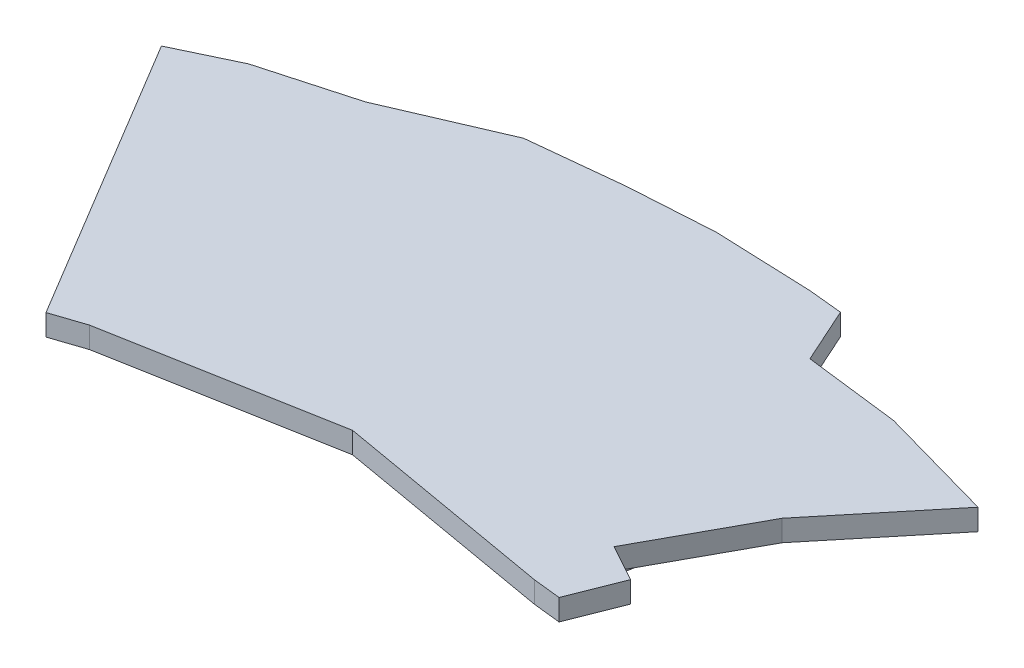
from build123d import *

# Parameters (mm, degrees)
BOSS_EXTRUDE1_DEPTH = 0.1
BOSS_EXTRUDE2_DEPTH = 0.3
BOSS_EXTRUDE3_DEPTH = 1.6
BOSS_EXTRUDE4_DEPTH = 1
BOSS_EXTRUDE6_DEPTH = 2


with BuildPart() as part:
    # Sketch1 → Boss-Extrude1 (new body)
    with BuildSketch(Plane(origin=(0, 0, 0), x_dir=(1, 0, 0), z_dir=(0, 1, 0))):
        Polygon((-10.891797249, 26.577808825), (-5.79351947, 9.149986826), (-2.397224373, 3.489407839), (5.640466214, 5.66196227), (-0.734212813, 29.279724171), align=None)
    extrude(amount=-BOSS_EXTRUDE1_DEPTH)



with BuildPart() as body_2:
    # Sketch1<4> → Boss-Extrude2 (new body)
    with BuildSketch(Plane(origin=(0, 0, 0), x_dir=(1, 0, 0), z_dir=(0, 1, 0))):
        Polygon((18.007446345, 34.7772024), (7.705525211, 33.438949507), (11.001219022, 9.275344539), (21.345127352, 10.801402821), align=None)
    extrude(amount=-BOSS_EXTRUDE2_DEPTH)


with BuildPart() as body_3:
    # Sketch1<6> → Boss-Extrude3 (new body)
    with BuildSketch(Plane(origin=(0, 0, 0), x_dir=(1, 0, 0), z_dir=(0, 1, 0))):
        Polygon((34.248462201, 34.6301789), (23.994142325, 35.215869617), (23.110432029, 10.99610324), (33.233450435, 10.417934204), align=None)
    extrude(amount=-BOSS_EXTRUDE3_DEPTH)


with BuildPart() as body_4:
    # Sketch1<7> → Boss-Extrude4 (new body)
    with BuildSketch(Plane(origin=(0, 0, 0), x_dir=(1, 0, 0), z_dir=(0, 1, 0))):
        Polygon((48.452043785, 27.653721075), (38.309825185, 29.363057326), (34.143873473, 5.198308151), (44.159317146, 3.708440275), align=None)
    extrude(amount=-BOSS_EXTRUDE4_DEPTH)


with BuildPart() as part_1:
    add(part.part)

    add(body_2.part)  # Boss-Extrude6 merges body 2

    add(body_3.part)  # Boss-Extrude6 merges body 3

    add(body_4.part)  # Boss-Extrude6 merges body 4
    # Sketch1<9> → Boss-Extrude6 (add)
    with BuildSketch(Plane(origin=(0, 0, 0), x_dir=(1, 0, 0), z_dir=(0, 1, 0))):
        Polygon((-10.986197156, 29.721735633), (-16.549013322, 27.076085928), (-0.25286222, -0.084584113), (2.807938166, 0.939274203), (23.783364855, 4.743803832), (44.5054493, 1.124608783), (47.119494483, 0.837420224), (49.023338551, 5.65160383), (45.570660298, 7.575242468), (51.160151479, 17.793063144), (59.478406067, 27.913224514), (48.433689461, 31.007653737), (39.469998377, 32.102859377), (37.111434986, 37.337196557), (33.923134788, 37.655423442), (24.762205898, 38.01292185), (16.732720281, 37.515854171), (8.013100705, 36.602302747), (-2.397224373, 32.120681941), align=None)
    extrude(amount=BOSS_EXTRUDE6_DEPTH)


solid = part_1.part
